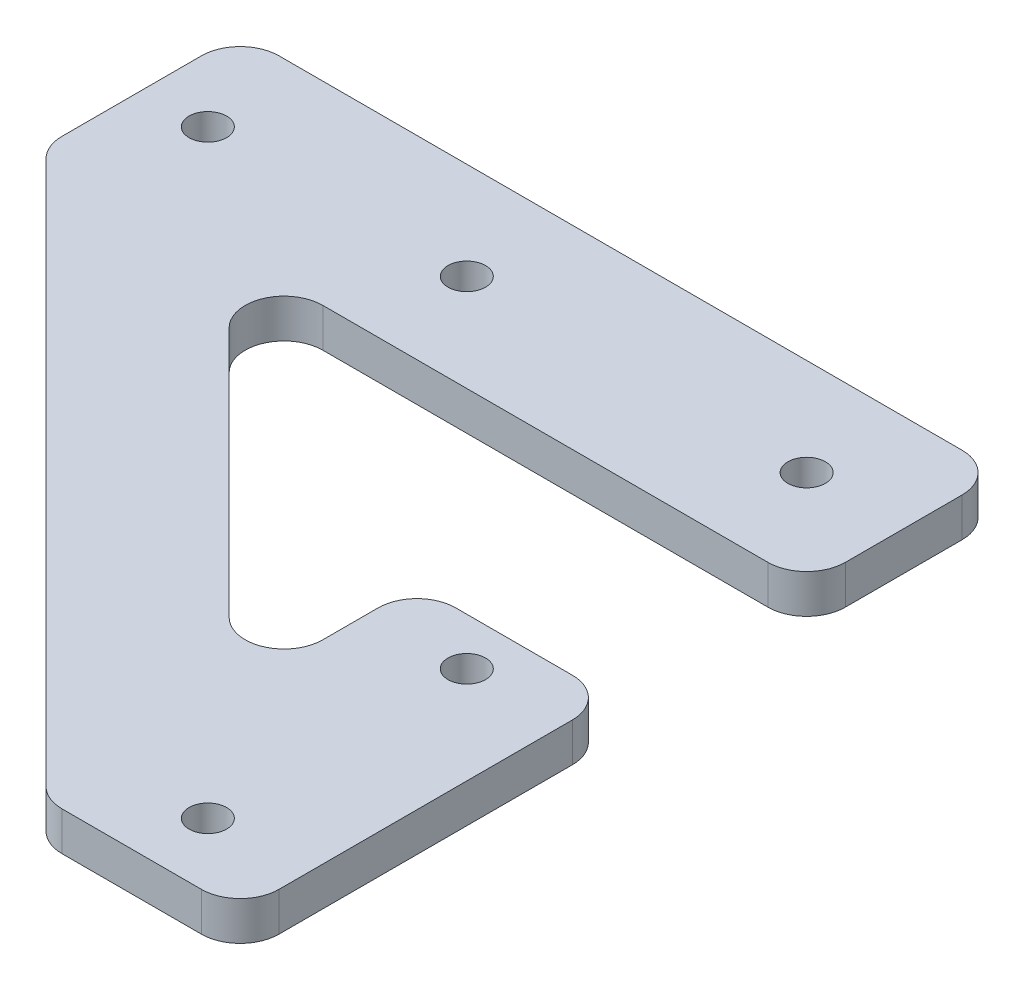
from build123d import *

# Parameters (mm, degrees)
SKETCH_1_R          = 1.45
EXTRUDE_1_DEPTH     = 3
EXTRUDE_2_DEPTH     = 3
SKETCH_4_W          = 43.75
SKETCH_4_H          = 58.75
CUT_EXTRUDE_2_DEPTH = 79.02002948
SKETCH_5_W          = 15
SKETCH_5_H          = 15
CUT_EXTRUDE_3_DEPTH = 79.02002948
SKETCH_6_W          = 15
SKETCH_6_H          = 3
CUT_EXTRUDE_4_DEPTH = 0.1
FILLET_1_R          = 3


with BuildPart() as part:
    # 草图1 → 凸台-拉伸1 (new body)
    with BuildSketch(Plane(origin=(0, 0, 0), x_dir=(1, 0, 0), z_dir=(0, 1, 0))):
        Polygon((-51.25, 0), (0, 0), (51.25, 0), (51.25, -15), (7.5, -15), (7.5, -58.75), (-7.5, -58.75), (-7.5, -15), (-51.25, -15), align=None)
        with Locations(Location((0, -7.5, 0), (0, 0, 270))):
            Circle(SKETCH_1_R, mode=Mode.SUBTRACT)
        with Locations(Location((0, -33.75, 0), (0, 0, 270))):
            Circle(SKETCH_1_R, mode=Mode.SUBTRACT)
        with Locations(Location((0, -53.75, 0), (0, 0, 270))):
            Circle(SKETCH_1_R, mode=Mode.SUBTRACT)
        with Locations(Location((-26.25, -7.5, 0), (0, 0, 270))):
            Circle(SKETCH_1_R, mode=Mode.SUBTRACT)
        with Locations(Location((-46.25, -7.5, 0), (0, 0, 270))):
            Circle(SKETCH_1_R, mode=Mode.SUBTRACT)
        with Locations(Location((46.25, -7.5, 0), (0, 0, 90))):
            Circle(SKETCH_1_R, mode=Mode.SUBTRACT)
        with Locations(Location((26.25, -7.5, 0), (0, 0, 90))):
            Circle(SKETCH_1_R, mode=Mode.SUBTRACT)
    extrude(amount=EXTRUDE_1_DEPTH)

    # 草图2 → 凸台-拉伸2 (add)
    with BuildSketch(Plane(origin=(0, 3, 0), x_dir=(1, 0, 0), z_dir=(0, 1, 0))):
        Polygon((-51.25, -15), (-7.5, -58.75), (-7.5, -44.607864376), (-37.107864376, -15), align=None)
        Polygon((37.107864376, -15), (51.25, -15), (7.5, -58.75), (7.5, -44.607864376), align=None)
    extrude(amount=-EXTRUDE_2_DEPTH)

    # 草图4 → 切除-拉伸2 (cut, through all)
    with BuildSketch(Plane(origin=(0, 3, 0), x_dir=(1, 0, 0), z_dir=(0, 1, 0))):
        with Locations((29.375, -29.375)):
            Rectangle(SKETCH_4_W, SKETCH_4_H)
    extrude(amount=-CUT_EXTRUDE_2_DEPTH, mode=Mode.SUBTRACT)

    # 草图5 → 切除-拉伸3 (cut, through all)
    with BuildSketch(Plane(origin=(0, 3, 0), x_dir=(1, 0, 0), z_dir=(0, 1, 0))):
        with Locations((0, -22.5)):
            Rectangle(SKETCH_5_W, SKETCH_5_H)
    extrude(amount=-CUT_EXTRUDE_3_DEPTH, mode=Mode.SUBTRACT)

    # 草图6 → 切除-拉伸4 (cut)
    with BuildSketch(Plane(origin=(0, 0, 30), x_dir=(-1, 0, 0), z_dir=(0, 0, -1))):
        with Locations((0, 1.5)):
            Rectangle(SKETCH_6_W, SKETCH_6_H)
    extrude(amount=-CUT_EXTRUDE_4_DEPTH, mode=Mode.SUBTRACT)

    # 圆角1
    fillet_1_edges = [part.edges().sort_by_distance(p)[0] for p in [
        (7.5, 1.5, 15),
        (-7.5, 1.5, 30.1),
        (7.5, 1.5, 30.1),
        (-51.25, 1.5, 0),
        (7.5, 1.5, 58.75),
        (-7.5, 1.5, 58.75),
        (-51.25, 1.5, 15),
        (-7.5, 1.5, 44.607864376),
        (-37.107864376, 1.5, 15),
        (7.5, 1.5, 0),
    ]]
    fillet(fillet_1_edges, radius=FILLET_1_R)


solid = part.part
